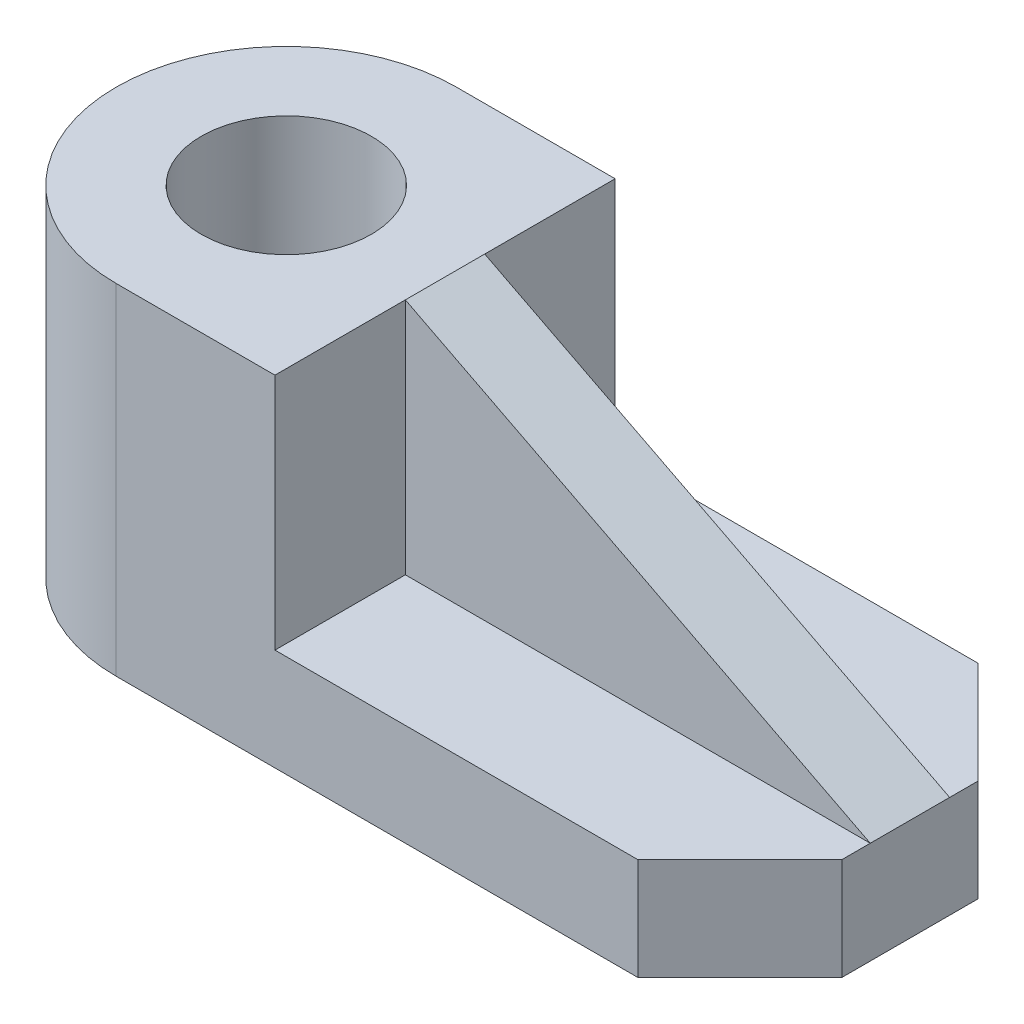
from build123d import *

# Parameters (mm, degrees)
EXTRUDE_1_DEPTH = 30
EXTRUDE_2_DEPTH = 9
EXTRUDE_START   = -15
EXTRUDE_3_DEPTH = 3.5


with BuildPart() as part:
    # 스케치1 → 보스-돌출1 (new body)
    with BuildSketch(Plane(origin=(0, 0, 0), x_dir=(1, 0, 0), z_dir=(0, 1, 0))):
        with BuildLine():
            Line((0, -15), (14, -15))
            Line((14, -15), (14, 15))
            Line((14, 15), (0, 15))
            ThreePointArc((0, 15), (-15, 0), (0, -15))
        make_face()
        with BuildLine():
            ThreePointArc((7.5, 0), (5.303300859, -5.303300859), (0, -7.5))
            ThreePointArc((0, -7.5), (-7.5, 0), (0, 7.5))
            ThreePointArc((0, 7.5), (5.303300859, 5.303300859), (7.5, 0))
        make_face(mode=Mode.SUBTRACT)
    extrude(amount=EXTRUDE_1_DEPTH)

    # 스케치1<3> → 보스-돌출2 (add)
    with BuildSketch(Plane(origin=(0, 0, 0), x_dir=(1, 0, 0), z_dir=(0, 1, 0))):
        Polygon((14, 15), (14, -15), (46, -15), (55, -6), (55, 6), (46, 15), align=None)
    extrude(amount=EXTRUDE_2_DEPTH)

    # 스케치2 → 보스-돌출3 (add, symmetric)
    with BuildSketch(Plane.XY.offset(15).offset(EXTRUDE_START)):
        Polygon((14, 30), (55, 9), (14, 9), align=None)
    extrude(amount=EXTRUDE_3_DEPTH, both=True)


solid = part.part
